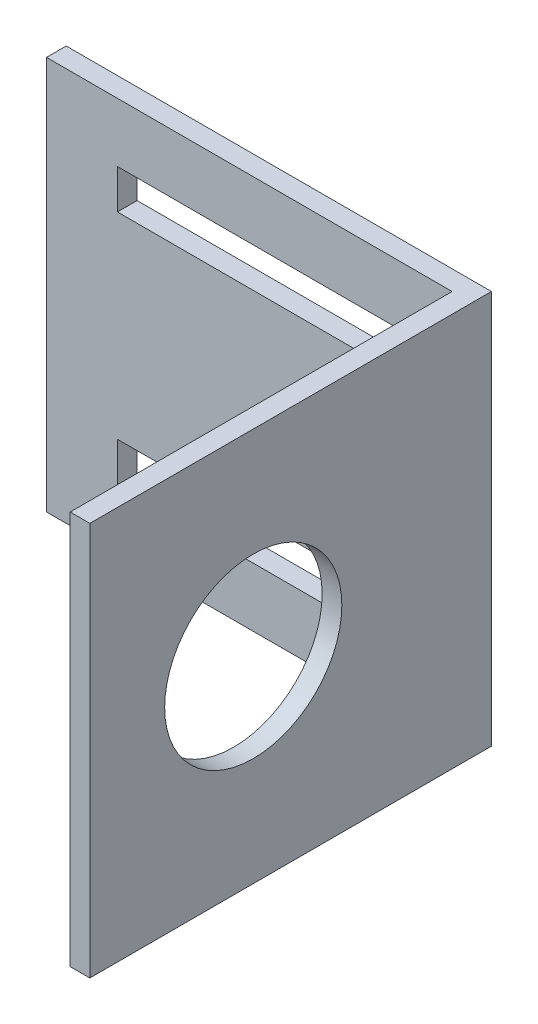
from build123d import *

# Parameters (mm, degrees)
SKETCH1_W           = 54
SKETCH1_H           = 50
BOSS_EXTRUDE1_DEPTH = 2.5
SKETCH2_W           = 2.5
SKETCH2_H           = 50
BOSS_EXTRUDE2_DEPTH = 51
SKETCH3_R           = 11.25
CUT_EXTRUDE1_DEPTH  = 51
SKETCH4_W           = 35
SKETCH4_H           = 5
CUT_EXTRUDE2_DEPTH  = 51


with BuildPart() as part:
    # Sketch1 → Boss-Extrude1 (new body)
    with BuildSketch(Plane.XY):
        Rectangle(SKETCH1_W, SKETCH1_H)
    extrude(amount=BOSS_EXTRUDE1_DEPTH)

    # Sketch2 → Boss-Extrude2 (add)
    with BuildSketch(Plane.XY):
        with Locations((25.75, 0)):
            Rectangle(SKETCH2_W, SKETCH2_H)
    extrude(amount=BOSS_EXTRUDE2_DEPTH)

    # Sketch3 → Cut-Extrude1 (cut)
    with BuildSketch(Plane(origin=(0, 0, 0), x_dir=(0, 0, -1), z_dir=(1, 0, 0))):
        with Locations(Location((-30.25, 0, 0), (0, 0, 180))):
            Circle(SKETCH3_R)
    extrude(amount=CUT_EXTRUDE1_DEPTH, mode=Mode.SUBTRACT)

    # Sketch4 → Cut-Extrude2 (cut)
    with BuildSketch(Plane.XY):
        with Locations((-0.5, 15)):
            Rectangle(SKETCH4_W, SKETCH4_H)
        with Locations((-0.5, -15)):
            Rectangle(SKETCH4_W, SKETCH4_H)
    extrude(amount=CUT_EXTRUDE2_DEPTH, mode=Mode.SUBTRACT)


solid = part.part
